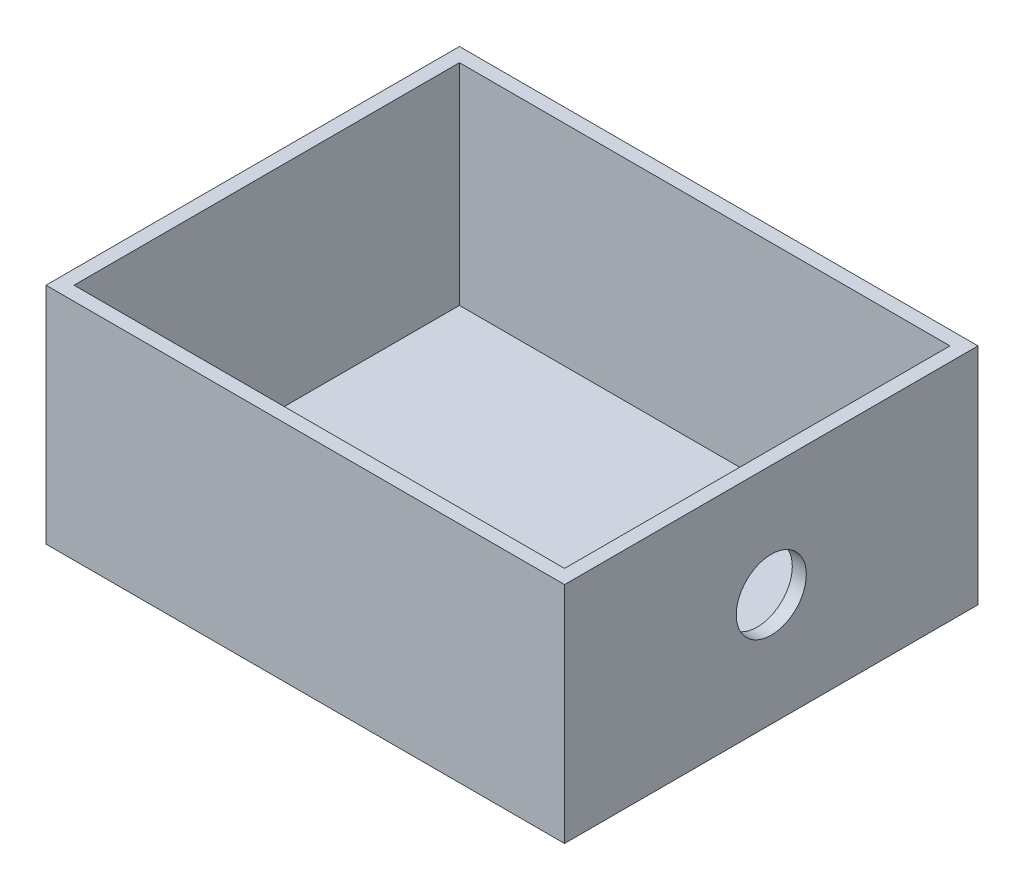
from build123d import *

# Parameters (mm, degrees)
SKETCH1_W           = 74
SKETCH1_H           = 59
BOSS_EXTRUDE1_DEPTH = 32
SHELL1_T            = -2
SKETCH2_R           = 5
CUT_EXTRUDE1_DEPTH  = 3


with BuildPart() as part:
    # Sketch1 → Boss-Extrude1 (new body)
    with BuildSketch(Plane(origin=(0, 0, 0), x_dir=(1, 0, 0), z_dir=(0, 1, 0))):
        Rectangle(SKETCH1_W, SKETCH1_H)
    extrude(amount=BOSS_EXTRUDE1_DEPTH)

    # Shell1
    shell1_openings = [part.faces().sort_by_distance(p)[0] for p in [
        (0, 32, 0),
    ]]
    offset(amount=SHELL1_T, openings=shell1_openings, kind=Kind.INTERSECTION)

    # Sketch2 → Cut-Extrude1 (cut)
    with BuildSketch(Plane(origin=(37, 0, 0), x_dir=(0, 0, -1), z_dir=(1, 0, 0))):
        with Locations((0, 16)):
            Circle(SKETCH2_R)
    extrude(amount=-CUT_EXTRUDE1_DEPTH, mode=Mode.SUBTRACT)


solid = part.part
